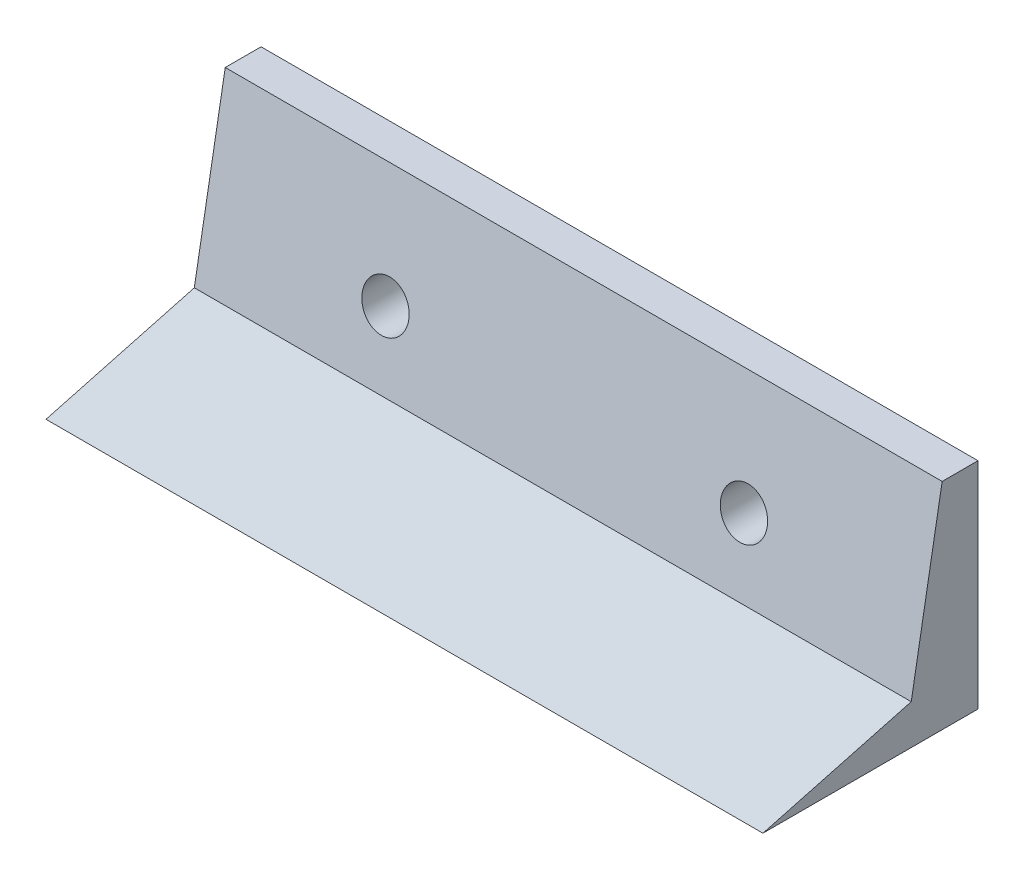
from build123d import *

# Parameters (mm, degrees)
BOSS_EXTRUDE1_DEPTH  = 100
M3_CLEARANCE_HOLE1_D = 3.4
SKETCH4_R            = 3.25
CUT_EXTRUDE1_DEPTH   = 108.964114408


with BuildPart() as part:
    # Sketch1 → Boss-Extrude1 (new body)
    with BuildSketch(Plane(origin=(0, 0, 0), x_dir=(0, 0, -1), z_dir=(1, 0, 0))):
        Polygon((0, 0), (0, 30), (-5, 30), (-9.312388631, 5.54322876), (-30, 0), align=None)
    extrude(amount=BOSS_EXTRUDE1_DEPTH)

    # M3 Clearance Hole1 (through all)
    with Locations(Plane(origin=(0, 0, 0), x_dir=(-1, 0, 0), z_dir=(0, 0, -1))):
        with Locations((-25, 15), (-75, 15)):
            Hole(M3_CLEARANCE_HOLE1_D / 2)

    # Sketch4 → Cut-Extrude1 (cut, through all)
    with BuildSketch(Plane(origin=(0, 0, 2.5), x_dir=(-1, 0, 0), z_dir=(0, 0, -1))):
        with Locations((-75, 15)):
            Circle(SKETCH4_R)
        with Locations((-25, 15)):
            Circle(SKETCH4_R)
    extrude(amount=-CUT_EXTRUDE1_DEPTH, mode=Mode.SUBTRACT)


solid = part.part
